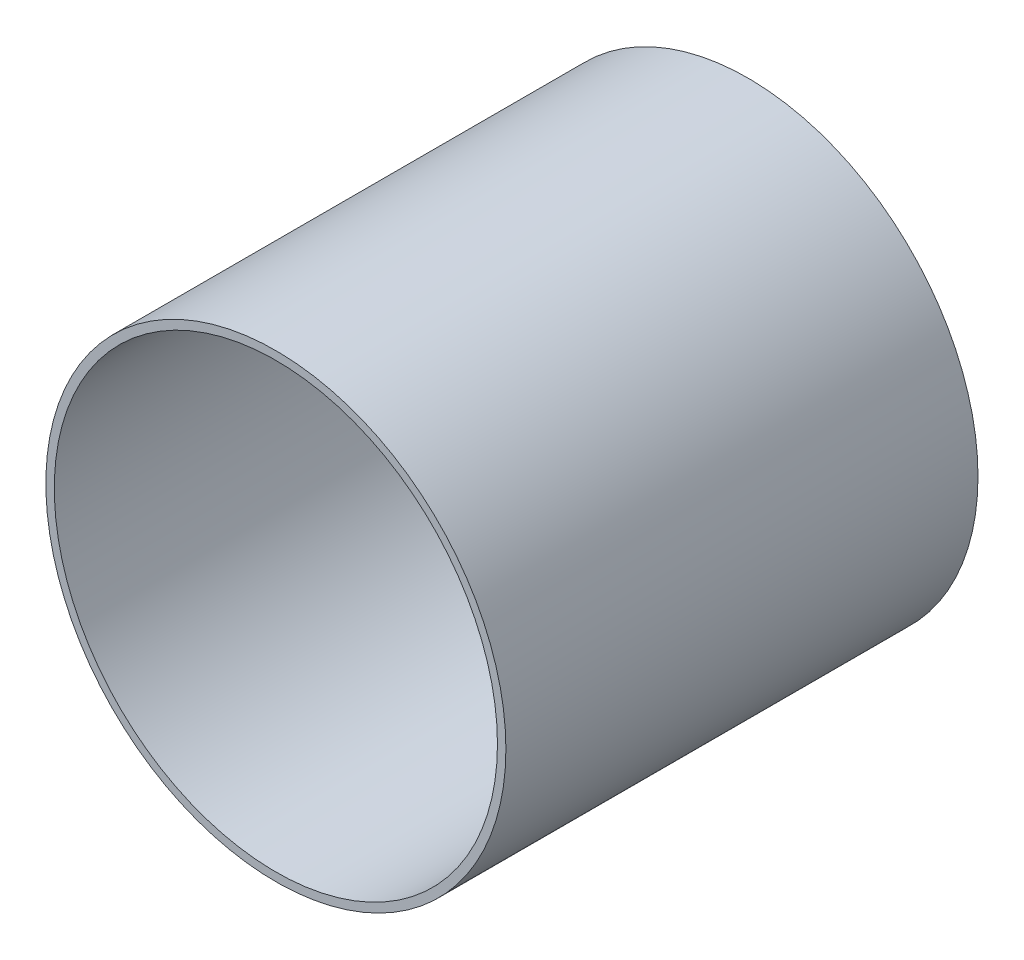
from build123d import *

# Parameters (mm, degrees)
SKETCH1_R           = 49.5046
SKETCH1_R_2         = 47.6885
BOSS_EXTRUDE1_DEPTH = 101.6


with BuildPart() as part:
    # Sketch1 → Boss-Extrude1 (new body)
    with BuildSketch(Plane.XY):
        Circle(SKETCH1_R)
        Circle(SKETCH1_R_2, mode=Mode.SUBTRACT)
    extrude(amount=BOSS_EXTRUDE1_DEPTH)


solid = part.part
